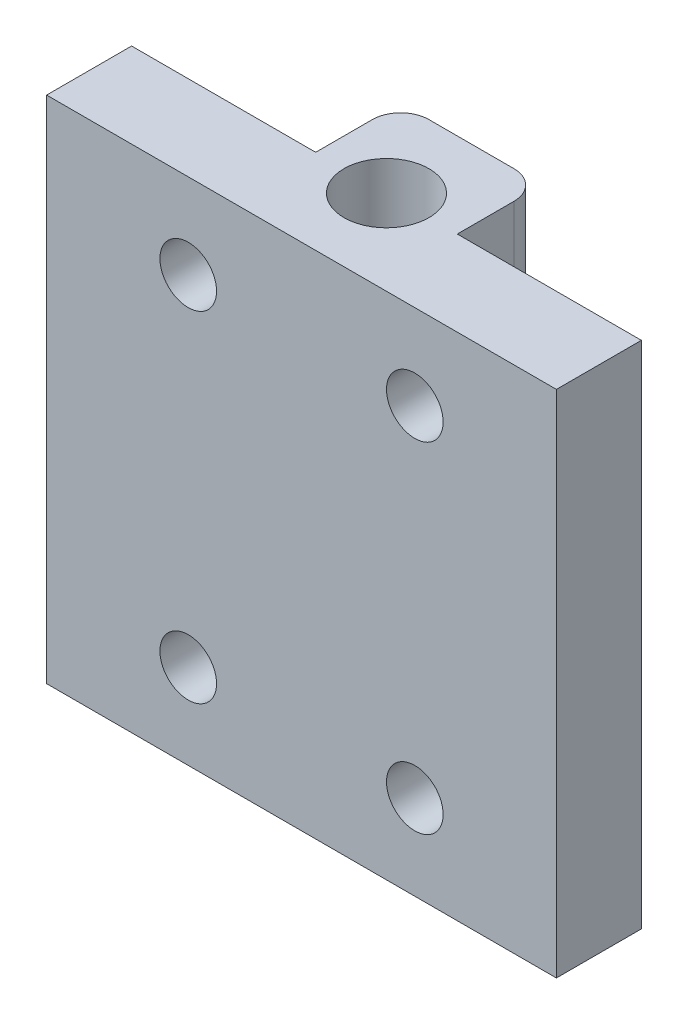
from build123d import *

# Parameters (mm, degrees)
SKETCH_1_W          = 18
SKETCH_1_H          = 18
EXTRUDE_1_DEPTH     = 3
SKETCH_4_R          = 1
CUT_EXTRUDE_1_DEPTH = 14.076696831
SKETCH_8_W          = 5
SKETCH_8_H          = 3
EXTRUDE_4_DEPTH     = 18
SKETCH_9_R          = 1.5
CUT_EXTRUDE_3_DEPTH = 21.346989949
FILLET_3_R          = 1


with BuildPart() as part:
    # 草图1 → 凸台-拉伸1 (new body)
    with BuildSketch(Plane.XY):
        Rectangle(SKETCH_1_W, SKETCH_1_H)
    extrude(amount=EXTRUDE_1_DEPTH)

    # 草图4 → 切除-拉伸1 (cut, through all)
    with BuildSketch(Plane.XY.offset(3)):
        with Locations((-4, -6)):
            Circle(SKETCH_4_R)
        with Locations((4, -6)):
            Circle(SKETCH_4_R)
        with Locations((4, 6)):
            Circle(SKETCH_4_R)
        with Locations((-4, 6)):
            Circle(SKETCH_4_R)
    extrude(amount=-CUT_EXTRUDE_1_DEPTH, mode=Mode.SUBTRACT)

    # 草图8 → 凸台-拉伸4 (add)
    with BuildSketch(Plane(origin=(0, 9, 0), x_dir=(1, 0, 0), z_dir=(0, 1, 0))):
        with Locations((0, 1.5)):
            Rectangle(SKETCH_8_W, SKETCH_8_H)
    extrude(amount=-EXTRUDE_4_DEPTH)

    # 草图9 → 切除-拉伸3 (cut, through all)
    with BuildSketch(Plane(origin=(0, 9, 0), x_dir=(1, 0, 0), z_dir=(0, 1, 0))):
        with Locations(Location((0, 0, 0), (0, 0, 180))):
            Circle(SKETCH_9_R)
    extrude(amount=-CUT_EXTRUDE_3_DEPTH, mode=Mode.SUBTRACT)

    # 圆角3
    fillet_3_edges = [part.edges().sort_by_distance(p)[0] for p in [
        (-2.5, 0, -3),
        (2.5, 0, -3),
    ]]
    fillet(fillet_3_edges, radius=FILLET_3_R)


solid = part.part
